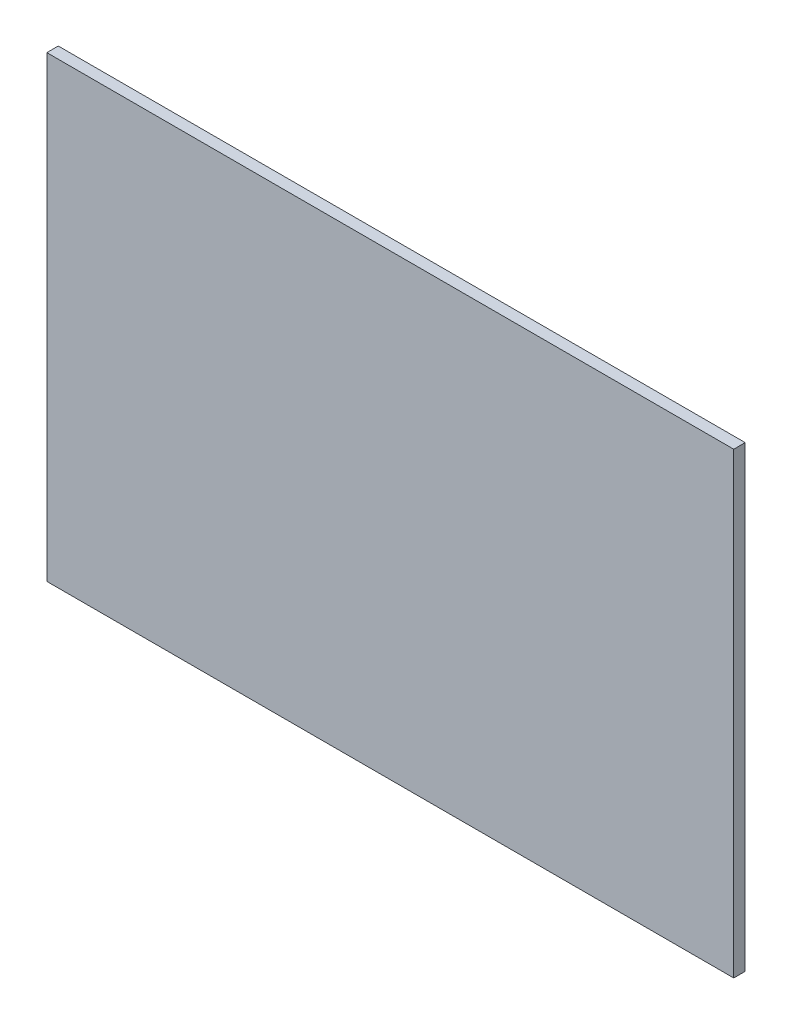
from build123d import *

# Parameters (mm, degrees)
SKETCH1_W           = 480
SKETCH1_H           = 320
BOSS_EXTRUDE1_DEPTH = 8


with BuildPart() as part:
    # Sketch1 → Boss-Extrude1 (new body)
    with BuildSketch(Plane.XY):
        Rectangle(SKETCH1_W, SKETCH1_H)
    extrude(amount=BOSS_EXTRUDE1_DEPTH)


solid = part.part
